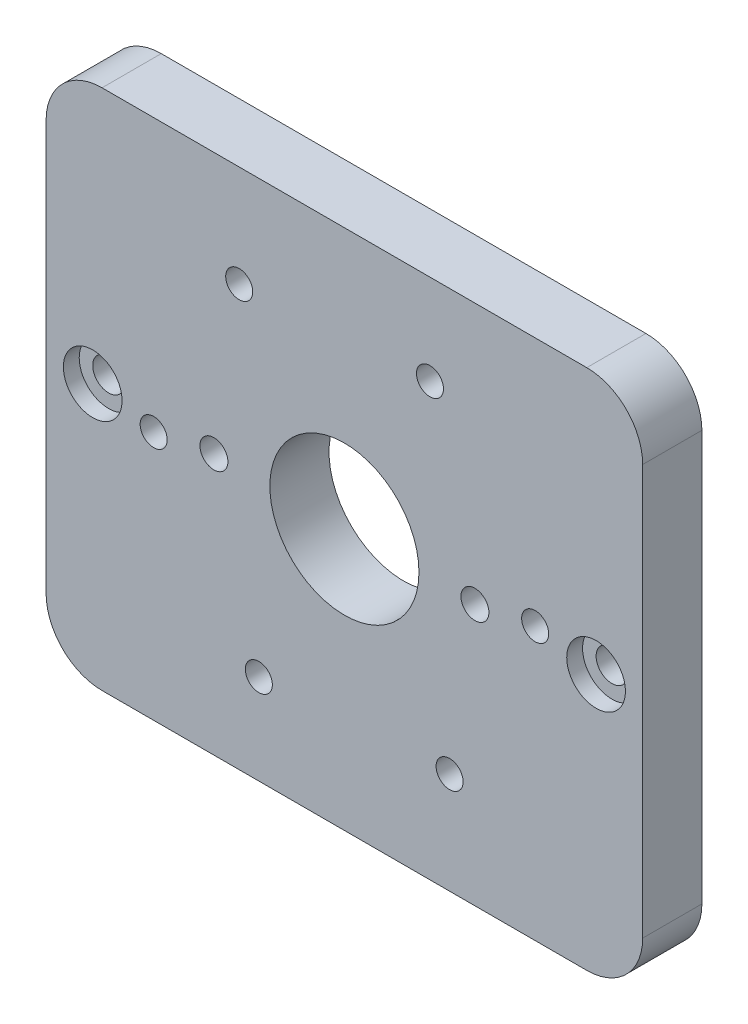
from build123d import *

# Parameters (mm, degrees)
REPISA_M6_START                       = 366.55
REPISA_M6_DEPTH                       = 6.35
BARRENOS_M6_TORNILLOS_PASADORES_START = 366.55
CROQUIS2_R                            = 1.45
CROQUIS2_R_2                          = 8
CROQUIS2_R_3                          = 1.7
CROQUIS2_R_4                          = 1.5
BARRENOS_M6_TORNILLOS_PASADORES_DEPTH = 6.35
REFRENTADO_M2_5_START                 = 366.55
CROQUIS3_R                            = 2.5
REFRENTADO_M2_5_DEPTH                 = 2.6
AVELLANADO_M3_START                   = 371.2
CROQUIS4_R                            = 3.15
AVELLANADO_M3_DEPTH                   = 1.7


with BuildPart() as part:
    # Croquis1 → Repisa_M6 (new body)
    with BuildSketch(Plane.XY.offset(REPISA_M6_START)):
        with BuildLine():
            Line((126.4, -28), (178.4, -28))
            ThreePointArc((178.4, -28), (182.642640687, -26.242640687), (184.4, -22))
            Line((184.4, -22), (184.4, 22))
            ThreePointArc((184.4, 22), (182.642640687, 26.242640687), (178.4, 28))
            Line((178.4, 28), (126.4, 28))
            ThreePointArc((126.4, 28), (122.157359313, 26.242640687), (120.4, 22))
            Line((120.4, 22), (120.4, -22))
            ThreePointArc((120.4, -22), (122.157359313, -26.242640687), (126.4, -28))
        make_face()
    extrude(amount=REPISA_M6_DEPTH)

    # Croquis2 → Barrenos_M6_tornillos_pasadores (cut)
    with BuildSketch(Plane.XY.offset(BARRENOS_M6_TORNILLOS_PASADORES_START)):
        with Locations((172.863916472, 1.215780658)):
            Circle(CROQUIS2_R)
        with Locations((161.579061301, 18.330161855)):
            Circle(CROQUIS2_R)
        with Locations((141.115144828, 17.114381197)):
            Circle(CROQUIS2_R)
        with Locations((131.936083528, -1.215780658)):
            Circle(CROQUIS2_R)
        with Locations((143.220938699, -18.330161855)):
            Circle(CROQUIS2_R)
        with Locations((163.684855172, -17.114381197)):
            Circle(CROQUIS2_R)
        with Locations((152.4, 0)):
            Circle(CROQUIS2_R_2)
        with Locations((125.4, 0)):
            Circle(CROQUIS2_R_3)
        with Locations((179.4, 0)):
            Circle(CROQUIS2_R_3)
        with Locations((138.4, 0)):
            Circle(CROQUIS2_R_4)
        with Locations((166.4, 0)):
            Circle(CROQUIS2_R_4)
    extrude(amount=BARRENOS_M6_TORNILLOS_PASADORES_DEPTH, mode=Mode.SUBTRACT)

    # Croquis3 → Refrentado_M2-5 (cut)
    with BuildSketch(Plane.XY.offset(REFRENTADO_M2_5_START)):
        with Locations((172.863916472, 1.215780658)):
            Circle(CROQUIS3_R)
        with Locations((161.579061301, 18.330161855)):
            Circle(CROQUIS3_R)
        with Locations((141.115144828, 17.114381197)):
            Circle(CROQUIS3_R)
        with Locations((131.936083528, -1.215780658)):
            Circle(CROQUIS3_R)
        with Locations((143.220938699, -18.330161855)):
            Circle(CROQUIS3_R)
        with Locations((163.684855172, -17.114381197)):
            Circle(CROQUIS3_R)
    extrude(amount=REFRENTADO_M2_5_DEPTH, mode=Mode.SUBTRACT)

    # Croquis4 → Avellanado_M3 (cut)
    with BuildSketch(Plane.XY.offset(AVELLANADO_M3_START)):
        with Locations(Location((125.4, 0, 0), (0, 0, 180))):
            Circle(CROQUIS4_R)
        with Locations(Location((179.4, 0, 0), (0, 0, 180))):
            Circle(CROQUIS4_R)
    extrude(amount=AVELLANADO_M3_DEPTH, mode=Mode.SUBTRACT)


solid = part.part
